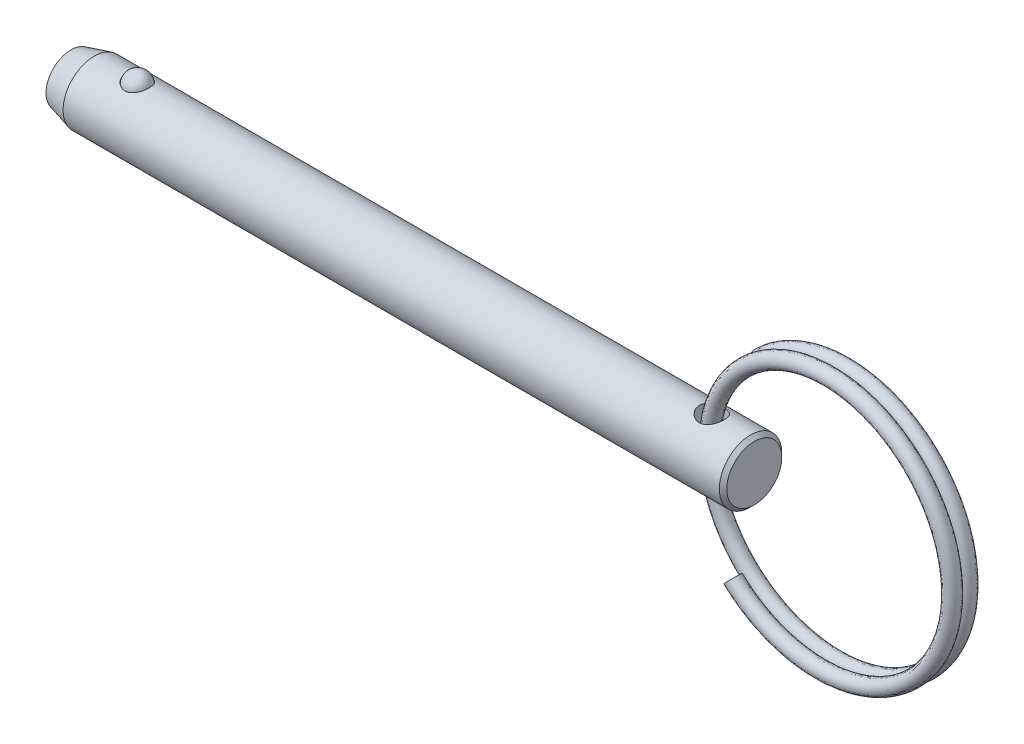
from build123d import *

# Parameters (mm, degrees)
SKETCH4_W          = 1.27
SKETCH4_H          = 6.35
SWEEP1_PITCH       = 1.5494
SWEEP1_HEIGHT      = 1.355725
SWEEP1_RADIUS      = 13.462
SKETCH6_R          = 0.762
SWEEP2_PITCH       = 1.5494
SWEEP2_HEIGHT      = 1.355725
SWEEP2_RADIUS      = 13.462
SWEEP2_START_ANGLE = -180
SKETCH6_2_R        = 0.762


with BuildPart() as part:
    # Sketch1 → Revolve1 (revolve)
    with BuildSketch(Plane.XY, mode=Mode.PRIVATE) as revolve1_sk:
        Polygon((34.6964, 2.794), (34.3154, 3.175), (-32.326547737, 3.175), (-34.6964, 2.54), (-34.6964, 0), (34.6964, 0), align=None)
    revolve(revolve1_sk.sketch.rotate(Axis((34.6964, 0, 0), (1, 0, 0)), 90), axis=Axis((34.6964, 0, 0), (1, 0, 0)))

    # Sketch2 → Cut-Revolve1 (revolve, cut)
    with BuildSketch(Plane.XY):
        with BuildLine():
            Line((-26.704582051, 2.8575), (-29.219182051, 2.8575))
            ThreePointArc((-29.219182051, 2.8575), (-27.961882051, 4.1148), (-26.704582051, 2.8575))
        make_face()
    revolve(axis=Axis((-26.704582051, 2.8575, 0), (1, 0, 0)), mode=Mode.SUBTRACT)

    # Sketch4 → Cut-Revolve2 (revolve, cut)
    with BuildSketch(Plane.XY, mode=Mode.PRIVATE) as cut_revolve2_sk:
        with Locations((31.0134, 0)):
            Rectangle(SKETCH4_W, SKETCH4_H)
    revolve(cut_revolve2_sk.sketch.rotate(Axis((30.3784, -3.175, 0), (0, 1, 0)), 90), axis=Axis((30.3784, -3.175, 0), (0, 1, 0)), mode=Mode.SUBTRACT)


with BuildPart() as body_2:
    # Sketch3 → Revolve2 (revolve)
    with BuildSketch(Plane.XY):
        with BuildLine():
            Line((-26.729982051, 2.8575), (-29.193782051, 2.8575))
            ThreePointArc((-29.193782051, 2.8575), (-27.961882051, 4.0894), (-26.729982051, 2.8575))
        make_face()
    revolve(axis=Axis((-26.729982051, 2.8575, 0), (1, 0, 0)))


with BuildPart() as body_3:
    # Sweep1: sweep along a helix
    with BuildLine() as sweep1_path:
        Helix(SWEEP1_PITCH, SWEEP1_HEIGHT, SWEEP1_RADIUS, center=(42.863425091, 0, 0), direction=(0, 0, -1), lefthand=True)
    # Sketch6 → Sweep1 (sweep)
    with BuildSketch(Plane(origin=(114.003847968, 0, 0), x_dir=(0, 0, -1), z_dir=(0, 1, 0))):
        with Locations((0, 83.840422877)):
            Circle(SKETCH6_R)
    sweep(path=sweep1_path.line, is_frenet=True)

    # Sweep2: sweep along a helix
    with BuildLine() as sweep2_path:
        add(Helix(SWEEP2_PITCH, SWEEP2_HEIGHT, SWEEP2_RADIUS, center=(42.863425091, 0, 0), direction=(0, 0, 1), lefthand=True, mode=Mode.PRIVATE).rotate(Axis((42.863425091, 0, 0), (0, 0, 1)), SWEEP2_START_ANGLE))
    # Sketch6<2> → Sweep2 (sweep)
    with BuildSketch(Plane(origin=(114.003847968, 0, 0), x_dir=(0, 0, -1), z_dir=(0, 1, 0))):
        with Locations((0, 83.840422877)):
            Circle(SKETCH6_2_R)
    sweep(path=sweep2_path.line, is_frenet=True)


solid = Compound([part.part, body_2.part, body_3.part])
